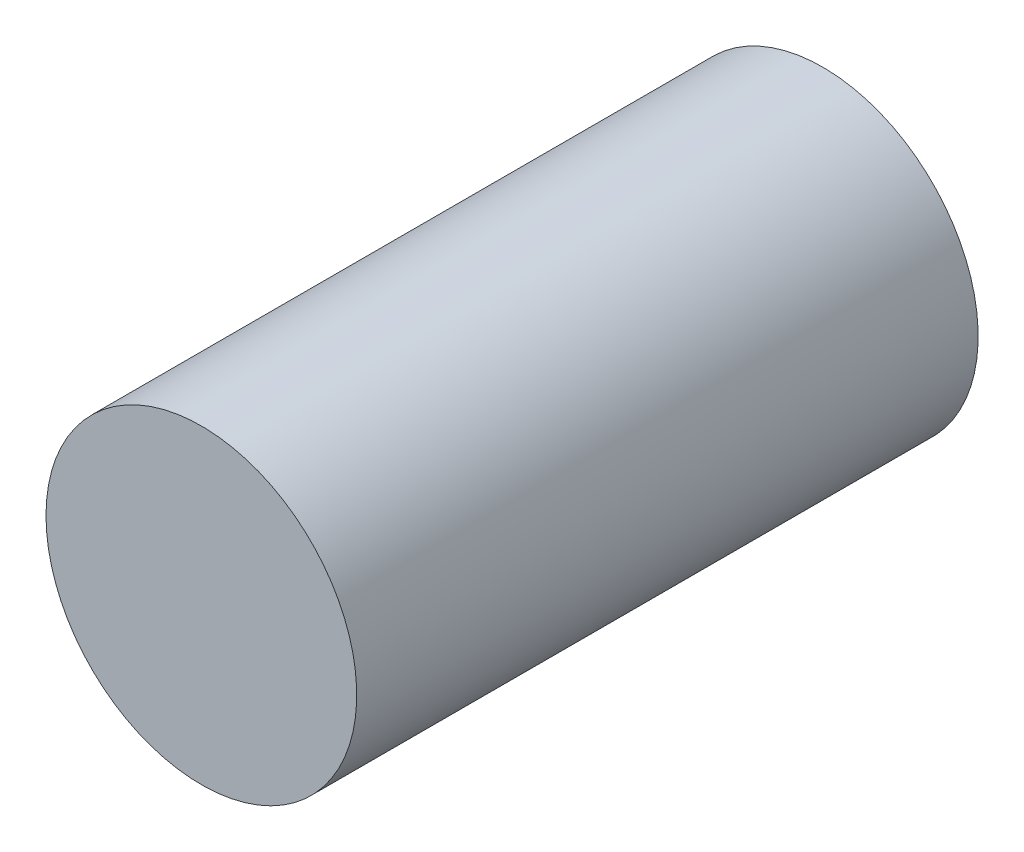
from build123d import *

# Parameters (mm, degrees)
SKETCH1_R           = 38.1
BOSS_EXTRUDE1_DEPTH = 152.4


with BuildPart() as part:
    # Sketch1 → Boss-Extrude1 (new body)
    with BuildSketch(Plane.XY):
        with Locations(Location((0, 0, 0), (0, 0, 180))):
            Circle(SKETCH1_R)
    extrude(amount=BOSS_EXTRUDE1_DEPTH)


solid = part.part
